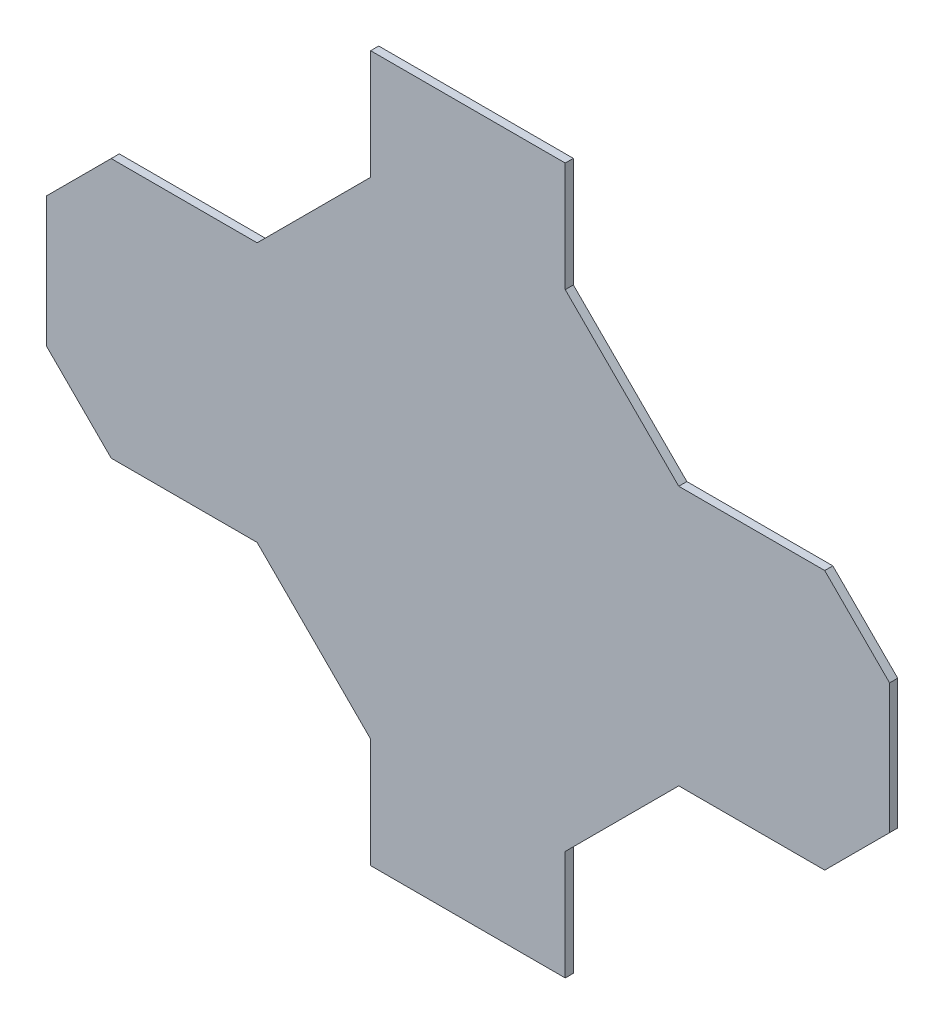
from build123d import *

# Parameters (mm, degrees)
SKETCH1_W           = 120
SKETCH1_H           = 137.6
SKETCH1_W_2         = 200
SKETCH1_H_2         = 160
BOSS_EXTRUDE1_DEPTH = 5
CHAMFER1_SIZE       = 70
CHAMFER2_SIZE       = 40


with BuildPart() as part:
    # Sketch1 → Boss-Extrude1 (new body)
    with BuildSketch(Plane.XY):
        with Locations((0, 323.8)):
            Rectangle(SKETCH1_W, SKETCH1_H)
        with Locations((-160, 175)):
            Rectangle(SKETCH1_W_2, SKETCH1_H_2)
        with Locations((0, 175)):
            Rectangle(SKETCH1_W, SKETCH1_H_2)
        with Locations((160, 175)):
            Rectangle(SKETCH1_W_2, SKETCH1_H_2)
        with Locations((0, 26.2)):
            Rectangle(SKETCH1_W, SKETCH1_H)
    extrude(amount=BOSS_EXTRUDE1_DEPTH)

    # Chamfer1
    chamfer1_edges = [part.edges().sort_by_distance(p)[0] for p in [
        (60, 255, 2.5),
        (60, 95, 2.5),
        (-60, 95, 2.5),
        (-60, 255, 2.5),
    ]]
    chamfer(chamfer1_edges, length=CHAMFER1_SIZE)

    # Chamfer2
    chamfer2_edges = [part.edges().sort_by_distance(p)[0] for p in [
        (260, 255, 2.5),
        (260, 95, 2.5),
        (-260, 95, 2.5),
        (-260, 255, 2.5),
    ]]
    chamfer(chamfer2_edges, length=CHAMFER2_SIZE)


solid = part.part
